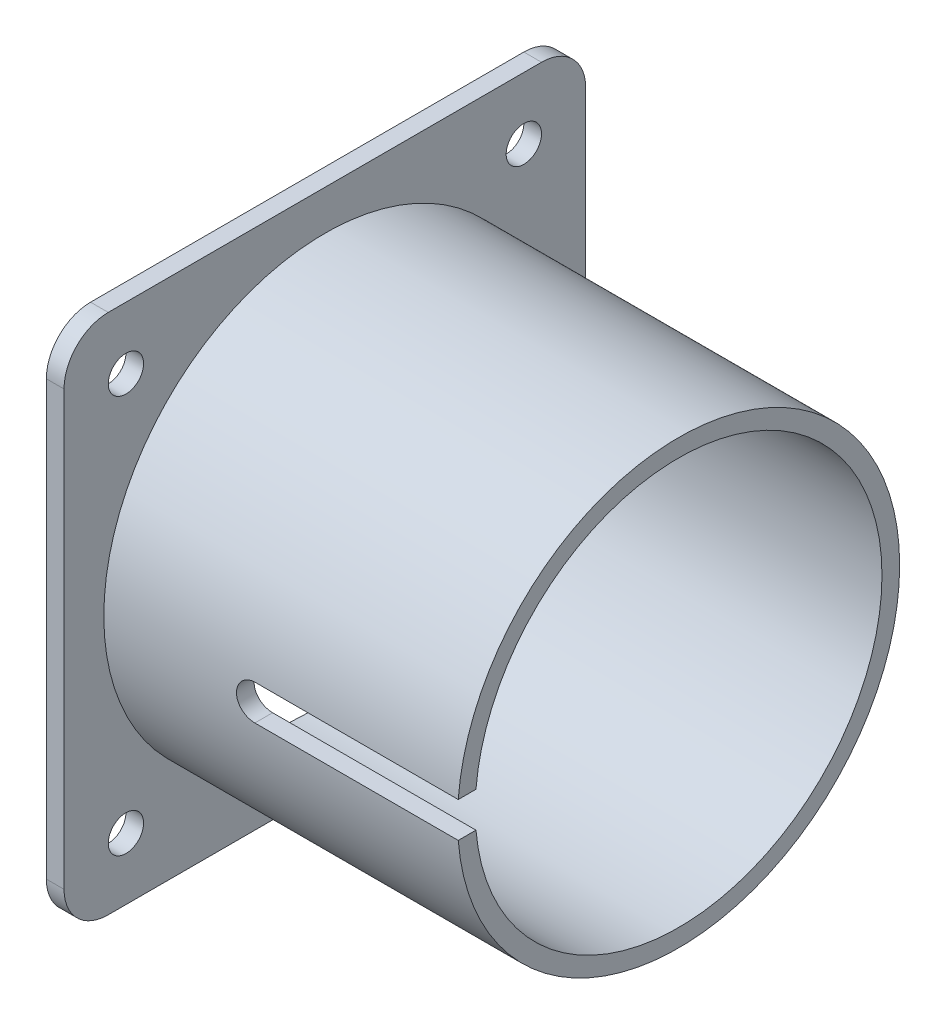
from build123d import *

# Parameters (mm, degrees)
CROQUIS1_R              = 46
CROQUIS1_R_2            = 4
SALIENTE_EXTRUIR1_DEPTH = 4
CROQUIS2_R              = 50
CROQUIS2_R_2            = 46
SALIENTE_EXTRUIR2_DEPTH = 80
CORTAR_EXTRUIR1_DEPTH   = 10
CROQUIS4_R              = 54
CROQUIS4_R_2            = 50
CORTAR_EXTRUIR2_DEPTH   = 3


with BuildPart() as part:
    # Croquis1 → Saliente-Extruir1 (new body)
    with BuildSketch(Plane(origin=(0, 0, 0), x_dir=(0, 0, -1), z_dir=(1, 0, 0))):
        with BuildLine():
            Line((-49, 59), (49, 59))
            ThreePointArc((49, 59), (56.071067812, 56.071067812), (59, 49))
            Line((59, 49), (59, -49))
            ThreePointArc((59, -49), (56.071067812, -56.071067812), (49, -59))
            Line((49, -59), (-49, -59))
            ThreePointArc((-49, -59), (-56.071067812, -56.071067812), (-59, -49))
            Line((-59, -49), (-59, 49))
            ThreePointArc((-59, 49), (-56.071067812, 56.071067812), (-49, 59))
        make_face()
        Circle(CROQUIS1_R, mode=Mode.SUBTRACT)
        with Locations((45, -45)):
            Circle(CROQUIS1_R_2, mode=Mode.SUBTRACT)
        with Locations((-45, -45)):
            Circle(CROQUIS1_R_2, mode=Mode.SUBTRACT)
        with Locations((-45, 45)):
            Circle(CROQUIS1_R_2, mode=Mode.SUBTRACT)
        with Locations((45, 45)):
            Circle(CROQUIS1_R_2, mode=Mode.SUBTRACT)
    extrude(amount=SALIENTE_EXTRUIR1_DEPTH)

    # Croquis2 → Saliente-Extruir2 (add)
    with BuildSketch(Plane(origin=(4, 0, 0), x_dir=(0, 0, -1), z_dir=(1, 0, 0))):
        Circle(CROQUIS2_R)
        Circle(CROQUIS2_R_2, mode=Mode.SUBTRACT)
    extrude(amount=SALIENTE_EXTRUIR2_DEPTH)

    # Croquis3 → Cortar-Extruir1 (cut)
    with BuildSketch(Plane.XY.offset(50)):
        with BuildLine():
            Line((84, 0), (84, 4))
            Line((84, 4), (38, 4))
            ThreePointArc((38, 4), (34, 0), (38, -4))
            Line((38, -4), (84, -4))
            Line((84, -4), (84, 0))
        make_face()
    extrude(amount=-CORTAR_EXTRUIR1_DEPTH, mode=Mode.SUBTRACT)

    # Croquis4 → Cortar-Extruir2 (cut)
    with BuildSketch(Plane.ZY):
        Circle(CROQUIS4_R)
        with Locations(Location((0, 0, 0), (0, 0, 355.411434264))):
            Circle(CROQUIS4_R_2, mode=Mode.SUBTRACT)
    extrude(amount=-CORTAR_EXTRUIR2_DEPTH, mode=Mode.SUBTRACT)


solid = part.part
